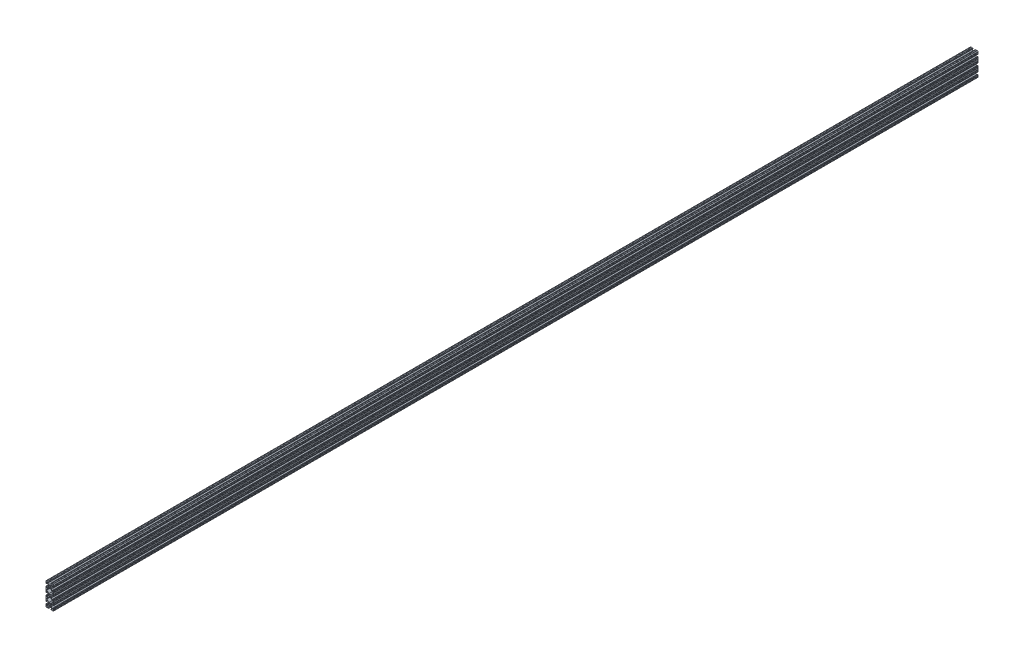
from build123d import *
from build123d.topology import SkipClean

# Parameters (mm, degrees)
BOSS_EXTRUDE1_DEPTH = 1524


with BuildPart() as part:
    # Sketch3 → Boss-Extrude1 (new, symmetric)
    with BuildSketch(Plane.XY):
        with BuildLine():
            Line((-4.5085, 1.724757315), (-4.5085, 0))
            Line((-4.5085, 0), (-2.6035, 0))
            ThreePointArc((-2.6035, 0), (-1.840952505, 1.840952505), (0, 2.6035))
            Line((0, 2.6035), (0, 4.5085))
            Line((0, 4.5085), (-1.757798948, 4.5085))
            ThreePointArc((-1.757798948, 4.5085), (-2.870757174, 4.729881156), (-3.8142776, 5.360321348))
            Line((-3.8142776, 5.360321348), (-9.773146637, 11.319190385))
            ThreePointArc((-9.773146637, 11.319190385), (-10.059460087, 11.747688744), (-10.16, 12.253137022))
            Line((-10.16, 12.253137022), (-10.16, 13.146862978))
            ThreePointArc((-10.16, 13.146862978), (-10.059460087, 13.652311256), (-9.773146637, 14.080809615))
            Line((-9.773146637, 14.080809615), (-3.8142776, 20.039678652))
            ThreePointArc((-3.8142776, 20.039678652), (-2.870757174, 20.670118844), (-1.757798948, 20.8915))
            Line((-1.757798948, 20.8915), (0, 20.8915))
            Line((0, 20.8915), (0, 22.7965))
            ThreePointArc((0, 22.7965), (-2.6035, 25.4), (0, 28.0035))
            Line((0, 28.0035), (0, 29.9085))
            Line((0, 29.9085), (-1.757798948, 29.9085))
            ThreePointArc((-1.757798948, 29.9085), (-2.870757174, 30.129881156), (-3.8142776, 30.760321348))
            Line((-3.8142776, 30.760321348), (-7.140358942, 34.086402691))
            ThreePointArc((-7.140358942, 34.086402691), (-7.369409702, 35.237918622), (-6.393201633, 35.8902))
            Line((-6.393201633, 35.8902), (-4.3561, 35.8902))
            ThreePointArc((-4.3561, 35.8902), (-3.2512, 36.9951), (-4.3561, 38.1))
            Line((-4.3561, 38.1), (-5.3086, 38.1))
            ThreePointArc((-5.3086, 38.1), (-5.8166, 37.592), (-6.3246, 38.1))
            Line((-6.3246, 38.1), (-9.5504, 38.1))
            ThreePointArc((-9.5504, 38.1), (-10.0584, 37.592), (-10.5664, 38.1))
            ThreePointArc((-10.5664, 38.1), (-12.079551533, 37.426060101), (-12.7, 35.8902))
            ThreePointArc((-12.7, 35.8902), (-12.192, 35.3822), (-12.7, 34.8742))
            Line((-12.7, 34.8742), (-12.7, 31.7246))
            ThreePointArc((-12.7, 31.7246), (-12.192, 31.2166), (-12.7, 30.7086))
            Line((-12.7, 30.7086), (-12.7, 29.7561))
            ThreePointArc((-12.7, 29.7561), (-11.5951, 28.6512), (-10.4902, 29.7561))
            Line((-10.4902, 29.7561), (-10.4902, 31.76016))
            ThreePointArc((-10.4902, 31.76016), (-9.837918622, 32.736368069), (-8.686402691, 32.507317309))
            Line((-8.686402691, 32.507317309), (-5.360321348, 29.181235967))
            ThreePointArc((-5.360321348, 29.181235967), (-4.729881156, 28.237715541), (-4.5085, 27.124757315))
            Line((-4.5085, 27.124757315), (-4.5085, 23.675242685))
            ThreePointArc((-4.5085, 23.675242685), (-4.729881156, 22.562284459), (-5.360321348, 21.618764033))
            Line((-5.360321348, 21.618764033), (-8.686402691, 18.292682691))
            ThreePointArc((-8.686402691, 18.292682691), (-9.837918622, 18.063631931), (-10.4902, 19.03984))
            Line((-10.4902, 19.03984), (-10.4902, 21.0439))
            ThreePointArc((-10.4902, 21.0439), (-11.5951, 22.1488), (-12.7, 21.0439))
            Line((-12.7, 21.0439), (-12.7, 20.0914))
            ThreePointArc((-12.7, 20.0914), (-12.192, 19.5834), (-12.7, 19.0754))
            Line((-12.7, 19.0754), (-12.7, 15.8496))
            ThreePointArc((-12.7, 15.8496), (-12.192, 15.3416), (-12.7, 14.8336))
            Line((-12.7, 14.8336), (-12.7, 10.5664))
            ThreePointArc((-12.7, 10.5664), (-12.192, 10.0584), (-12.7, 9.5504))
            Line((-12.7, 9.5504), (-12.7, 6.3246))
            ThreePointArc((-12.7, 6.3246), (-12.192, 5.8166), (-12.7, 5.3086))
            Line((-12.7, 5.3086), (-12.7, 4.3561))
            ThreePointArc((-12.7, 4.3561), (-11.5951, 3.2512), (-10.4902, 4.3561))
            Line((-10.4902, 4.3561), (-10.4902, 6.36016))
            ThreePointArc((-10.4902, 6.36016), (-9.837918622, 7.336368069), (-8.686402691, 7.107317309))
            Line((-8.686402691, 7.107317309), (-5.360321348, 3.781235967))
            ThreePointArc((-5.360321348, 3.781235967), (-4.729881156, 2.837715541), (-4.5085, 1.724757315))
        make_face()
    extrude(amount=BOSS_EXTRUDE1_DEPTH, both=True)

    # Mirror1: part across plane


with BuildPart() as part_1:
    with SkipClean():  # the faces are left unmerged after this step: merging them gives an invalid solid
        add(part.part)
        add(part.part.mirror(Plane(origin=(0, 0, 0), x_dir=(0, 0, 1), z_dir=(1, 0, 0))))

    # Mirror2: part across plane


with BuildPart() as part_2:
    with SkipClean():  # the faces are left unmerged after this step: merging them gives an invalid solid
        add(part_1.part)
        add(part_1.part.mirror(Plane.ZX))


solid = part_2.part
